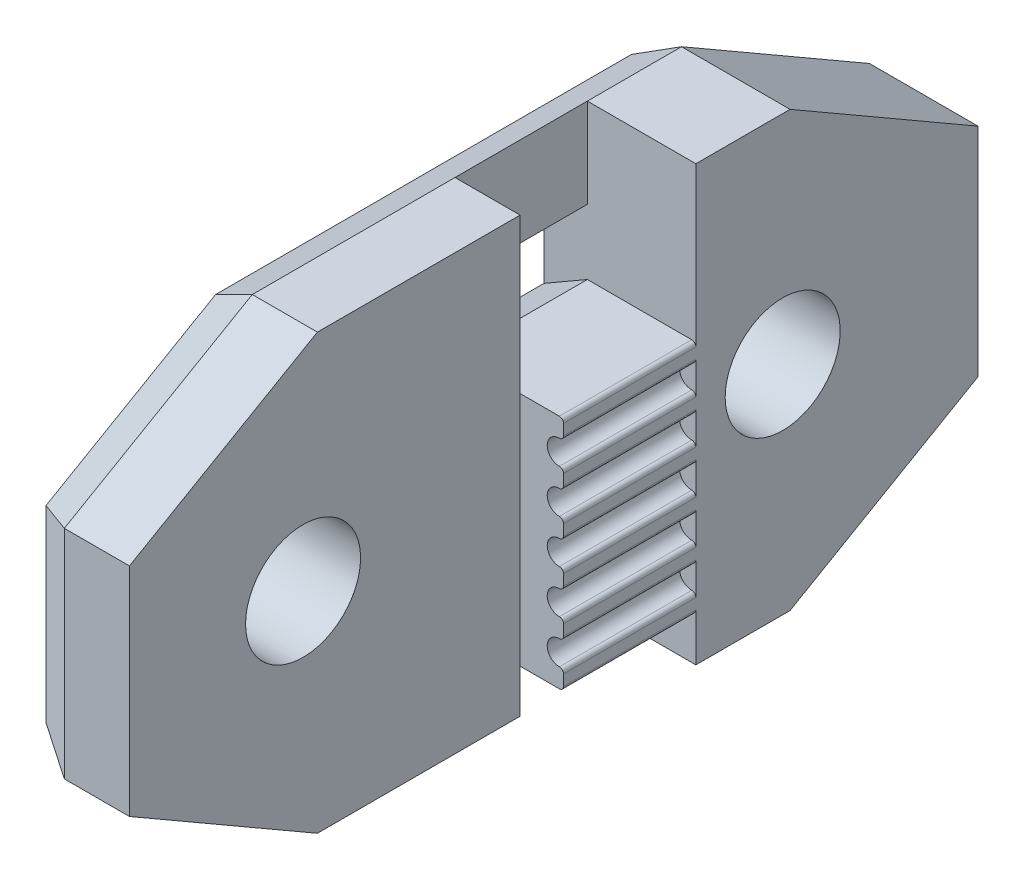
from build123d import *
from OCP.BRepFilletAPI import BRepFilletAPI_MakeChamfer

# Parameters (mm, degrees)
AUFSATZ_LINEAR_AUSTRAGEN1_DEPTH   = 6.1
AUFSATZ_LINEAR_AUSTRAGEN1_2_DEPTH = 6.1
SKIZZE2_W                         = 6
SKIZZE2_H                         = 10.88
SCHNITT_LINEAR_AUSTRAGEN1_DEPTH   = 6.1
SKIZZE3_R                         = 2.65
SKIZZE3_W                         = 6.1
SKIZZE3_H                         = 4.12
AUFSATZ_LINEAR_AUSTRAGEN2_DEPTH   = 2.19
SKIZZE4_R                         = 2.65
AUFSATZ_LINEAR_AUSTRAGEN3_DEPTH   = 4.81
SKIZZE5_R                         = 2.65
AUFSATZ_LINEAR_AUSTRAGEN4_DEPTH   = 0.19
FASE1_SIZE                        = 5
FASE1_SIZE2                       = 8.660254038
FASE2_SIZE                        = 2
FASE2_SIZE2                       = 1.154700538
SCHNITT_LINEAR_START              = -4
SCHNITT_LINEAR_AUSTRAGEN3_DEPTH   = 2.5
SCHNITT_LINEAR_AUSTRAGEN4_REACH   = 36.325
SKIZZE12_W                        = 5
SKIZZE12_H                        = 6.1


with BuildPart() as part:
    # Skizze1 → Aufsatz-Linear austragen1 (new body)
    with BuildSketch(Plane.XY):
        Polygon((0, 0), (0, 9.44), (0, 10.88), (-6, 10.88), (-6, 0), align=None)
    extrude(amount=AUFSATZ_LINEAR_AUSTRAGEN1_DEPTH)

    # Skizze2 → Schnitt-Linear austragen1 (cut)
    with BuildSketch(Plane.XY.offset(6.1)):
        with Locations((-3, 5.44)):
            Rectangle(SKIZZE2_W, SKIZZE2_H)
    extrude(amount=-SCHNITT_LINEAR_AUSTRAGEN1_DEPTH, mode=Mode.SUBTRACT)


with BuildPart() as body_2:
    # Skizze1 → Aufsatz-Linear austragen1 2 (new body)
    with BuildSketch(Plane.XY):
        with BuildLine():
            Line((-7.05, 10.19), (-7.05, 10.69))
            ThreePointArc((-7.05, 10.69), (-7.105649712, 10.824350288), (-7.24, 10.88))
            Line((-7.24, 10.88), (-9.24, 10.88))
            Line((-9.24, 10.88), (-9.24, 0))
            Line((-9.24, 0), (-7.24, 0))
            ThreePointArc((-7.24, 0), (-7.105649712, 0.055649712), (-7.05, 0.19))
            Line((-7.05, 0.19), (-7.05, 0.69))
            ThreePointArc((-7.05, 0.69), (-7.105649712, 0.824350288), (-7.24, 0.88))
            ThreePointArc((-7.24, 0.88), (-7.8, 1.44), (-7.24, 2))
            ThreePointArc((-7.24, 2), (-7.105649712, 2.055649712), (-7.05, 2.19))
            Line((-7.05, 2.19), (-7.05, 2.69))
            ThreePointArc((-7.05, 2.69), (-7.105649712, 2.824350288), (-7.24, 2.88))
            ThreePointArc((-7.24, 2.88), (-7.8, 3.44), (-7.24, 4))
            ThreePointArc((-7.24, 4), (-7.105649712, 4.055649712), (-7.05, 4.19))
            Line((-7.05, 4.19), (-7.05, 4.69))
            ThreePointArc((-7.05, 4.69), (-7.105649712, 4.824350288), (-7.24, 4.88))
            ThreePointArc((-7.24, 4.88), (-7.8, 5.44), (-7.24, 6))
            ThreePointArc((-7.24, 6), (-7.105649712, 6.055649712), (-7.05, 6.19))
            Line((-7.05, 6.19), (-7.05, 6.69))
            ThreePointArc((-7.05, 6.69), (-7.105649712, 6.824350288), (-7.24, 6.88))
            ThreePointArc((-7.24, 6.88), (-7.8, 7.44), (-7.24, 8))
            ThreePointArc((-7.24, 8), (-7.105649712, 8.055649712), (-7.05, 8.19))
            Line((-7.05, 8.19), (-7.05, 8.69))
            ThreePointArc((-7.05, 8.69), (-7.105649712, 8.824350288), (-7.24, 8.88))
            ThreePointArc((-7.24, 8.88), (-7.8, 9.44), (-7.24, 10))
            ThreePointArc((-7.24, 10), (-7.105649712, 10.055649712), (-7.05, 10.19))
        make_face()
    extrude(amount=AUFSATZ_LINEAR_AUSTRAGEN1_2_DEPTH)

    # Skizze3 → Aufsatz-Linear austragen2 (add)
    # profile 1 of 2: a face of its own
    with BuildSketch(Plane.ZY.offset(9.24)):
        Polygon((-13, -2), (0, -2), (0, 13.88), (0, 18), (-13, 18), align=None)
        with Locations((-4, 8)):
            Circle(SKIZZE3_R, mode=Mode.SUBTRACT)
    # profile 2 of 2: a face of its own
    with BuildSketch(Plane.ZY.offset(9.24)):
        with Locations((3.05, 15.94)):
            Rectangle(SKIZZE3_W, SKIZZE3_H)
    extrude(amount=-AUFSATZ_LINEAR_AUSTRAGEN2_DEPTH)

    # Skizze4 → Aufsatz-Linear austragen3 (add)
    # profile 1 of 2: a face of its own
    with BuildSketch(Plane.ZY.offset(9.24)):
        Polygon((24.1, 18), (6.1, 18), (6.1, 13.88), (6.1, 10.88), (6.1, 0), (6.1, -2), (24.1, -2), align=None)
        with Locations((16.1, 8)):
            Circle(SKIZZE4_R, mode=Mode.SUBTRACT)
    # profile 2 of 2: a face of its own
    with BuildSketch(Plane.ZY.offset(9.24)):
        Polygon((6.1, 0), (6.1, 10.88), (0, 10.88), (0, 13.88), (6.1, 13.88), (6.1, 18), (-13, 18), (-13, -2), (0, -2), (0, 0), align=None)
        with Locations((-4, 8)):
            Circle(SKIZZE4_R, mode=Mode.SUBTRACT)
    extrude(amount=AUFSATZ_LINEAR_AUSTRAGEN3_DEPTH)

    # Skizze5 → Aufsatz-Linear austragen4 (add)
    with BuildSketch(Plane(origin=(-9.24, 0, 0), x_dir=(0, 0, -1), z_dir=(1, 0, 0))):
        Polygon((-6.1, 13.88), (-6.1, 18), (-24.1, 18), (-24.1, -2), (-6.1, -2), (-6.1, 0), (-6.1, 10.88), align=None)
        with Locations(Location((-16.1, 8, 0), (0, 0, 180))):
            Circle(SKIZZE5_R, mode=Mode.SUBTRACT)
    extrude(amount=AUFSATZ_LINEAR_AUSTRAGEN4_DEPTH)

    # Fase1: one chamfer whose edges measure the first distance from different faces: ONE call of the kernel's chamfer builder (chamfer() names one face for all edges)
    fase1_edges_1 = [body_2.edges().sort_by_distance(p)[0] for p in [
        (-11.645, -2, 24.1),
        (-11.645, 18, 24.1),
    ]]
    fase1_side_1 = [body_2.faces().sort_by_distance(p)[0] for p in [
        (-11.645, 8, 24.1),
    ]]
    fase1_edges_2 = [body_2.edges().sort_by_distance(p)[0] for p in [
        (-10.55, -2, -13),
        (-10.55, 18, -13),
    ]]
    fase1_side_2 = [body_2.faces().sort_by_distance(p)[0] for p in [
        (-10.55, 8, -13),
    ]]
    fase1 = BRepFilletAPI_MakeChamfer(body_2.part.solid().wrapped)
    for e in fase1_edges_1:
        fase1.Add(FASE1_SIZE, FASE1_SIZE2, e.wrapped, fase1_side_1[0].wrapped)  # the first distance lies on this face
    for e in fase1_edges_2:
        fase1.Add(FASE1_SIZE, FASE1_SIZE2, e.wrapped, fase1_side_2[0].wrapped)  # the first distance lies on this face
    add(Compound.cast(fase1.Shape()), mode=Mode.REPLACE)

    # Fase2: one chamfer whose edges measure the first distance from different faces: ONE call of the kernel's chamfer builder (chamfer() names one face for all edges)
    fase2_edges_1 = [body_2.edges().sort_by_distance(p)[0] for p in [
        (-14.05, -2, 10.769872981),
    ]]
    fase2_side_1 = [body_2.faces().sort_by_distance(p)[0] for p in [
        (-11.645, -2, 10.769872981),
    ]]
    fase2_edges_2 = [body_2.edges().sort_by_distance(p)[0] for p in [
        (-14.05, 10.88, 3.05),
    ]]
    fase2_side_2 = [body_2.faces().sort_by_distance(p)[0] for p in [
        (-11.645, 10.88, 3.05),
    ]]
    fase2_edges_3 = [body_2.edges().sort_by_distance(p)[0] for p in [
        (-14.05, 13.88, 3.05),
    ]]
    fase2_side_3 = [body_2.faces().sort_by_distance(p)[0] for p in [
        (-10.55, 13.88, 3.05),
    ]]
    fase2_edges_4 = [body_2.edges().sort_by_distance(p)[0] for p in [
        (-14.05, 18, 5.55),
    ]]
    fase2_side_4 = [body_2.faces().sort_by_distance(p)[0] for p in [
        (-10.939880768, 18, 4.735948766),
    ]]
    fase2_edges_5 = [body_2.edges().sort_by_distance(p)[0] for p in [
        (-14.05, 8, 24.1),
    ]]
    fase2_side_5 = [body_2.faces().sort_by_distance(p)[0] for p in [
        (-11.645, 8, 24.1),
    ]]
    fase2_edges_6 = [body_2.edges().sort_by_distance(p)[0] for p in [
        (-14.05, 8, -13),
    ]]
    fase2_side_6 = [body_2.faces().sort_by_distance(p)[0] for p in [
        (-10.55, 8, -13),
    ]]
    fase2_edges_7 = [body_2.edges().sort_by_distance(p)[0] for p in [
        (-14.05, -2, -2.169872981),
    ]]
    fase2_side_7 = [body_2.faces().sort_by_distance(p)[0] for p in [
        (-10.55, -2, -2.169872981),
    ]]
    fase2_edges_8 = [body_2.edges().sort_by_distance(p)[0] for p in [
        (-14.05, 0.5, -8.669872981),
    ]]
    fase2_side_8 = [body_2.faces().sort_by_distance(p)[0] for p in [
        (-10.55, 0.5, -8.669872981),
    ]]
    fase2_edges_9 = [body_2.edges().sort_by_distance(p)[0] for p in [
        (-14.05, 0.5, 19.769872981),
    ]]
    fase2_side_9 = [body_2.faces().sort_by_distance(p)[0] for p in [
        (-11.645, 0.5, 19.769872981),
    ]]
    fase2_edges_10 = [body_2.edges().sort_by_distance(p)[0] for p in [
        (-14.05, 15.5, 19.769872981),
    ]]
    fase2_side_10 = [body_2.faces().sort_by_distance(p)[0] for p in [
        (-11.645, 15.5, 19.769872981),
    ]]
    fase2_edges_11 = [body_2.edges().sort_by_distance(p)[0] for p in [
        (-14.05, 15.5, -8.669872981),
    ]]
    fase2_side_11 = [body_2.faces().sort_by_distance(p)[0] for p in [
        (-10.55, 15.5, -8.669872981),
    ]]
    fase2 = BRepFilletAPI_MakeChamfer(body_2.part.solid().wrapped)
    for e in fase2_edges_1:
        fase2.Add(FASE2_SIZE, FASE2_SIZE2, e.wrapped, fase2_side_1[0].wrapped)  # the first distance lies on this face
    for e in fase2_edges_2:
        fase2.Add(FASE2_SIZE, FASE2_SIZE2, e.wrapped, fase2_side_2[0].wrapped)  # the first distance lies on this face
    for e in fase2_edges_3:
        fase2.Add(FASE2_SIZE, FASE2_SIZE2, e.wrapped, fase2_side_3[0].wrapped)  # the first distance lies on this face
    for e in fase2_edges_4:
        fase2.Add(FASE2_SIZE, FASE2_SIZE2, e.wrapped, fase2_side_4[0].wrapped)  # the first distance lies on this face
    for e in fase2_edges_5:
        fase2.Add(FASE2_SIZE, FASE2_SIZE2, e.wrapped, fase2_side_5[0].wrapped)  # the first distance lies on this face
    for e in fase2_edges_6:
        fase2.Add(FASE2_SIZE, FASE2_SIZE2, e.wrapped, fase2_side_6[0].wrapped)  # the first distance lies on this face
    for e in fase2_edges_7:
        fase2.Add(FASE2_SIZE, FASE2_SIZE2, e.wrapped, fase2_side_7[0].wrapped)  # the first distance lies on this face
    for e in fase2_edges_8:
        fase2.Add(FASE2_SIZE, FASE2_SIZE2, e.wrapped, fase2_side_8[0].wrapped)  # the first distance lies on this face
    for e in fase2_edges_9:
        fase2.Add(FASE2_SIZE, FASE2_SIZE2, e.wrapped, fase2_side_9[0].wrapped)  # the first distance lies on this face
    for e in fase2_edges_10:
        fase2.Add(FASE2_SIZE, FASE2_SIZE2, e.wrapped, fase2_side_10[0].wrapped)  # the first distance lies on this face
    for e in fase2_edges_11:
        fase2.Add(FASE2_SIZE, FASE2_SIZE2, e.wrapped, fase2_side_11[0].wrapped)  # the first distance lies on this face
    add(Compound.cast(fase2.Shape()), mode=Mode.REPLACE)

    # Skizze11 → Schnitt-Linear austragen3 (cut)
    with BuildSketch(Plane.XZ.offset(2).offset(SCHNITT_LINEAR_START)):
        with BuildLine():
            Line((-14.05, 7.6), (-14.05, 6.1))
            ThreePointArc((-14.05, 6.1), (-12.989339828, 5.660660172), (-12.55, 4.6))
            Line((-12.55, 4.6), (-12.55, 1.5))
            ThreePointArc((-12.55, 1.5), (-12.989339828, 0.439339828), (-14.05, 0))
            Line((-14.05, 0), (-14.05, -1.5))
            ThreePointArc((-14.05, -1.5), (-11.928679656, -0.621320344), (-11.05, 1.5))
            Line((-11.05, 1.5), (-11.05, 4.6))
            ThreePointArc((-11.05, 4.6), (-11.928679656, 6.721320344), (-14.05, 7.6))
        make_face()
    extrude(amount=-SCHNITT_LINEAR_AUSTRAGEN3_DEPTH, mode=Mode.SUBTRACT)

    # Schnitt-Linear austragen4: up to this plane
    schnitt_linear_austragen4_end = Plane(origin=(-14.05, 15.034700538, 6.1), z_dir=(0.4999999999999981, 0.8660254037844397, 0))
    # Skizze12 → Schnitt-Linear austragen4 (cut, up to the surface)
    with BuildSketch(Plane(origin=(0, 18, 0), x_dir=(1, 0, 0), z_dir=(0, 1, 0)), mode=Mode.PRIVATE) as schnitt_linear_austragen4_sk1:
        with Locations((-9.55, -3.05)):
            Rectangle(SKIZZE12_W, SKIZZE12_H)
    schnitt_linear_austragen4_tool1 = split(extrude(schnitt_linear_austragen4_sk1.sketch, amount=-SCHNITT_LINEAR_AUSTRAGEN4_REACH, mode=Mode.PRIVATE), bisect_by=schnitt_linear_austragen4_end, keep=Keep.BOTH, mode=Mode.PRIVATE)
    add(schnitt_linear_austragen4_tool1.solids().sort_by_distance((-9.55, 18, 3.05))[0], mode=Mode.SUBTRACT)


solid = body_2.part
